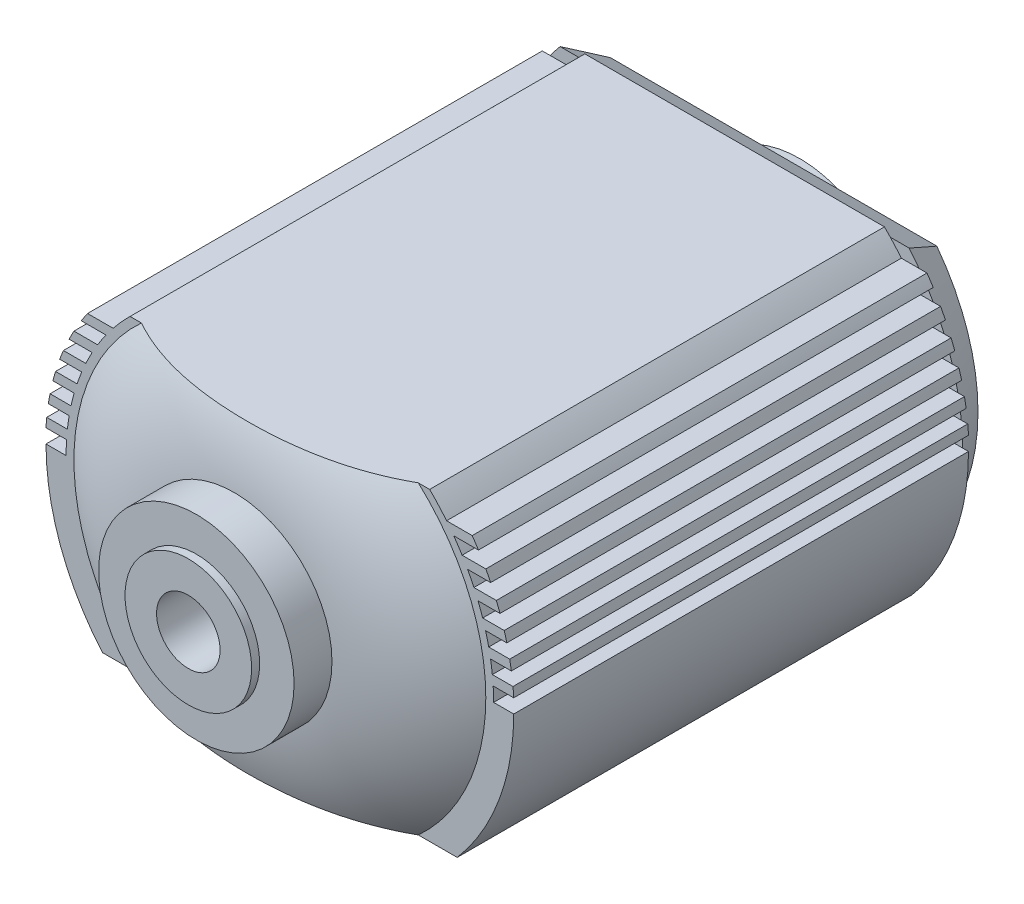
from build123d import *

# Parameters (mm, degrees)
ESQUISSE1_R             = 1.081511131
BOSS_EXTRU_1_DEPTH      = 3.5
ESQUISSE3_R             = 0.410372832
BOSS_EXTRU_2_DEPTH      = 0.3
BOSS_EXTRU_2_DRAFT      = 31
ESQUISSE4_W             = 2.396874893
ESQUISSE4_H             = 0.634189101
ESQUISSE4_W_2           = 2.754584076
ESQUISSE4_H_2           = 0.575875801
ENL_V_MAT_EXTRU_1_DEPTH = 10.3
ESQUISSE5_R             = 0.803157719
ESQUISSE5_R_2           = 0.244537362
BOSS_EXTRU_3_DEPTH      = 0.2


with BuildPart() as part:
    # Esquisse1 → Boss.-Extru.1 (new body)
    with BuildSketch(Plane.XY):
        with BuildLine():
            ThreePointArc((1.283053605, 1.029568507), (1.22008068, 1.103467715), (1.152857828, 1.173523196))
            Line((1.152857828, 1.173523196), (-1.152857828, 1.173523196))
            ThreePointArc((-1.152857828, 1.173523196), (-1.22008068, 1.103467715), (-1.283053605, 1.029568507))
            Line((-1.283053605, 1.029568507), (-1.480340364, 1.029568507))
            ThreePointArc((-1.480340364, 1.029568507), (-1.5047525, 0.993548599), (-1.528288379, 0.956950122))
            Line((-1.528288379, 0.956950122), (-1.338089806, 0.956950122))
            ThreePointArc((-1.338089806, 0.956950122), (-1.371169173, 0.908918567), (-1.402525217, 0.859744659))
            Line((-1.402525217, 0.859744659), (-1.585010418, 0.859744659))
            ThreePointArc((-1.585010418, 0.859744659), (-1.604065256, 0.823646502), (-1.622298103, 0.787126273))
            Line((-1.622298103, 0.787126273), (-1.444531098, 0.787126273))
            ThreePointArc((-1.444531098, 0.787126273), (-1.469769972, 0.738927665), (-1.493401198, 0.68992081))
            Line((-1.493401198, 0.68992081), (-1.665961638, 0.68992081))
            ThreePointArc((-1.665961638, 0.68992081), (-1.680479463, 0.653764236), (-1.694212685, 0.617302425))
            Line((-1.694212685, 0.617302425), (-1.524852642, 0.617302425))
            ThreePointArc((-1.524852642, 0.617302425), (-1.543534106, 0.568981833), (-1.56068479, 0.520096962))
            Line((-1.56068479, 0.520096962), (-1.726533537, 0.520096962))
            ThreePointArc((-1.726533537, 0.520096962), (-1.737027918, 0.483893496), (-1.746763243, 0.447478576))
            Line((-1.746763243, 0.447478576), (-1.583035308, 0.447478576))
            ThreePointArc((-1.583035308, 0.447478576), (-1.595928641, 0.399060944), (-1.607341473, 0.350273113))
            Line((-1.607341473, 0.350273113), (-1.768820977, 0.350273113))
            ThreePointArc((-1.768820977, 0.350273113), (-1.775613788, 0.314029584), (-1.781664041, 0.277654728))
            Line((-1.781664041, 0.277654728), (-1.621464066, 0.277654728))
            ThreePointArc((-1.621464066, 0.277654728), (-1.629026183, 0.22915401), (-1.635137892, 0.180449265))
            Line((-1.635137892, 0.180449265), (-1.794117323, 0.180449265))
            ThreePointArc((-1.794117323, 0.180449265), (-1.797396468, 0.144169491), (-1.799942056, 0.107830879))
            Line((-1.799942056, 0.107830879), (-1.64152684, 0.107830879))
            ThreePointArc((-1.64152684, 0.107830879), (-1.644179996, 0.05394445), (-1.645064699, 0))
            Line((-1.645064699, 0), (-1.799942056, 0))
            ThreePointArc((-1.799942056, 0), (-1.687649711, -0.62580337), (-1.364783761, -1.173523196))
            Line((-1.364783761, -1.173523196), (-1.152857828, -1.173523196))
            Line((-1.152857828, -1.173523196), (0, -1.173523196))
            Line((0, -1.173523196), (1.152857828, -1.173523196))
            Line((1.152857828, -1.173523196), (1.364783761, -1.173523196))
            ThreePointArc((1.364783761, -1.173523196), (1.687649711, -0.62580337), (1.799942056, 0))
            Line((1.799942056, 0), (1.645064699, 0))
            ThreePointArc((1.645064699, 0), (1.644179996, 0.05394445), (1.64152684, 0.107830879))
            Line((1.64152684, 0.107830879), (1.799942056, 0.107830879))
            ThreePointArc((1.799942056, 0.107830879), (1.797396468, 0.144169491), (1.794117323, 0.180449265))
            Line((1.794117323, 0.180449265), (1.635137892, 0.180449265))
            ThreePointArc((1.635137892, 0.180449265), (1.629026183, 0.22915401), (1.621464066, 0.277654728))
            Line((1.621464066, 0.277654728), (1.781664041, 0.277654728))
            ThreePointArc((1.781664041, 0.277654728), (1.775613788, 0.314029584), (1.768820977, 0.350273113))
            Line((1.768820977, 0.350273113), (1.607341473, 0.350273113))
            ThreePointArc((1.607341473, 0.350273113), (1.595928641, 0.399060944), (1.583035308, 0.447478576))
            Line((1.583035308, 0.447478576), (1.746763243, 0.447478576))
            ThreePointArc((1.746763243, 0.447478576), (1.737027918, 0.483893496), (1.726533537, 0.520096962))
            Line((1.726533537, 0.520096962), (1.56068479, 0.520096962))
            ThreePointArc((1.56068479, 0.520096962), (1.543534106, 0.568981833), (1.524852642, 0.617302425))
            Line((1.524852642, 0.617302425), (1.694212685, 0.617302425))
            ThreePointArc((1.694212685, 0.617302425), (1.680479463, 0.653764236), (1.665961638, 0.68992081))
            Line((1.665961638, 0.68992081), (1.493401198, 0.68992081))
            ThreePointArc((1.493401198, 0.68992081), (1.469769972, 0.738927665), (1.444531098, 0.787126273))
            Line((1.444531098, 0.787126273), (1.622298103, 0.787126273))
            ThreePointArc((1.622298103, 0.787126273), (1.604065256, 0.823646502), (1.585010418, 0.859744659))
            Line((1.585010418, 0.859744659), (1.402525217, 0.859744659))
            ThreePointArc((1.402525217, 0.859744659), (1.371169173, 0.908918567), (1.338089806, 0.956950122))
            Line((1.338089806, 0.956950122), (1.528288379, 0.956950122))
            ThreePointArc((1.528288379, 0.956950122), (1.5047525, 0.993548599), (1.480340364, 1.029568507))
            Line((1.480340364, 1.029568507), (1.283053605, 1.029568507))
        make_face()
        Circle(ESQUISSE1_R, mode=Mode.SUBTRACT)
    extrude(amount=BOSS_EXTRU_1_DEPTH)

    # Esquisse2 → Révolution1 (revolve)
    with BuildSketch(Plane(origin=(0, 0, 0), x_dir=(1, 0, 0), z_dir=(0, 1, 0))):
        with BuildLine():
            Line((1.585010418, -3.5), (0.244537362, -3.5))
            Line((0.244537362, -3.5), (0.244537362, -4.204593095))
            Line((0.244537362, -4.204593095), (0.487185346, -4.204593095))
            Line((0.487185346, -4.204593095), (0.487185346, -4.142746313))
            Line((0.487185346, -4.142746313), (0.752242982, -4.142746313))
            Line((0.752242982, -4.142746313), (0.752242982, -3.851182914))
            add(Edge.make_bspline(
                [(0.752242982, -3.851182914), (1.220495176, -3.803222811), (1.585010418, -3.5)],
                knots=[0, 0, 0, 1, 1, 1], degree=2))
        make_face()
    revolve(axis=Axis((0, 0, 3.5), (0, 0, -1)))


with BuildPart() as boss_extru_2_tool:
    # Esquisse3 → Boss.-Extru.2 (with draft: the straight prism first)
    with BuildSketch(Plane(origin=(0, 0, 0), x_dir=(-1, 0, 0), z_dir=(0, 0, -1))):
        with BuildLine():
            ThreePointArc((-1.343095681, 1.127120496), (-1.753370075, 0), (-1.343095681, -1.127120496))
            Line((-1.343095681, -1.127120496), (1.343095681, -1.127120496))
            ThreePointArc((1.343095681, -1.127120496), (1.753370075, 0), (1.343095681, 1.127120496))
            Line((1.343095681, 1.127120496), (-1.343095681, 1.127120496))
        make_face()
        Circle(ESQUISSE3_R, mode=Mode.SUBTRACT)
    extrude(amount=BOSS_EXTRU_2_DEPTH)
    # Boss.-Extru.2: the draft: its side faces are tilted about the plane it starts from
    boss_extru_2_sides = [boss_extru_2_tool.faces().sort_by_distance(p)[0] for p in [
        (1.753370075, 0, -0.15),
        (0, -1.127120496, -0.15),
        (-1.753370075, 0, -0.15),
        (0, 1.127120496, -0.15),
        (0.410372832, 0, -0.15),
    ]]
    draft(boss_extru_2_sides, Plane(origin=(0, 0, 0), x_dir=(-1, 0, 0), z_dir=(0, 0, -1)), BOSS_EXTRU_2_DRAFT)


with BuildPart() as part_1:
    add(part.part)

    # Boss.-Extru.2: add boss_extru_2_tool
    add(boss_extru_2_tool.part)

    # Esquisse4 → Enlèv. mat.-Extru.1 (cut)
    with BuildSketch(Plane(origin=(0, 0, -0.3), x_dir=(-1, 0, 0), z_dir=(0, 0, -1))):
        with Locations((0.045579618, 1.490617747)):
            Rectangle(ESQUISSE4_W, ESQUISSE4_H)
        with Locations((0.012508277, -1.461461097)):
            Rectangle(ESQUISSE4_W_2, ESQUISSE4_H_2)
    extrude(amount=-ENL_V_MAT_EXTRU_1_DEPTH, mode=Mode.SUBTRACT)

    # Esquisse5 → Boss.-Extru.3 (add)
    with BuildSketch(Plane(origin=(0, 0, -0.3), x_dir=(-1, 0, 0), z_dir=(0, 0, -1))):
        Circle(ESQUISSE5_R)
        with Locations(Location((0, 0, 0), (0, 0, 180))):
            Circle(ESQUISSE5_R_2, mode=Mode.SUBTRACT)
    extrude(amount=BOSS_EXTRU_3_DEPTH)


solid = part_1.part
